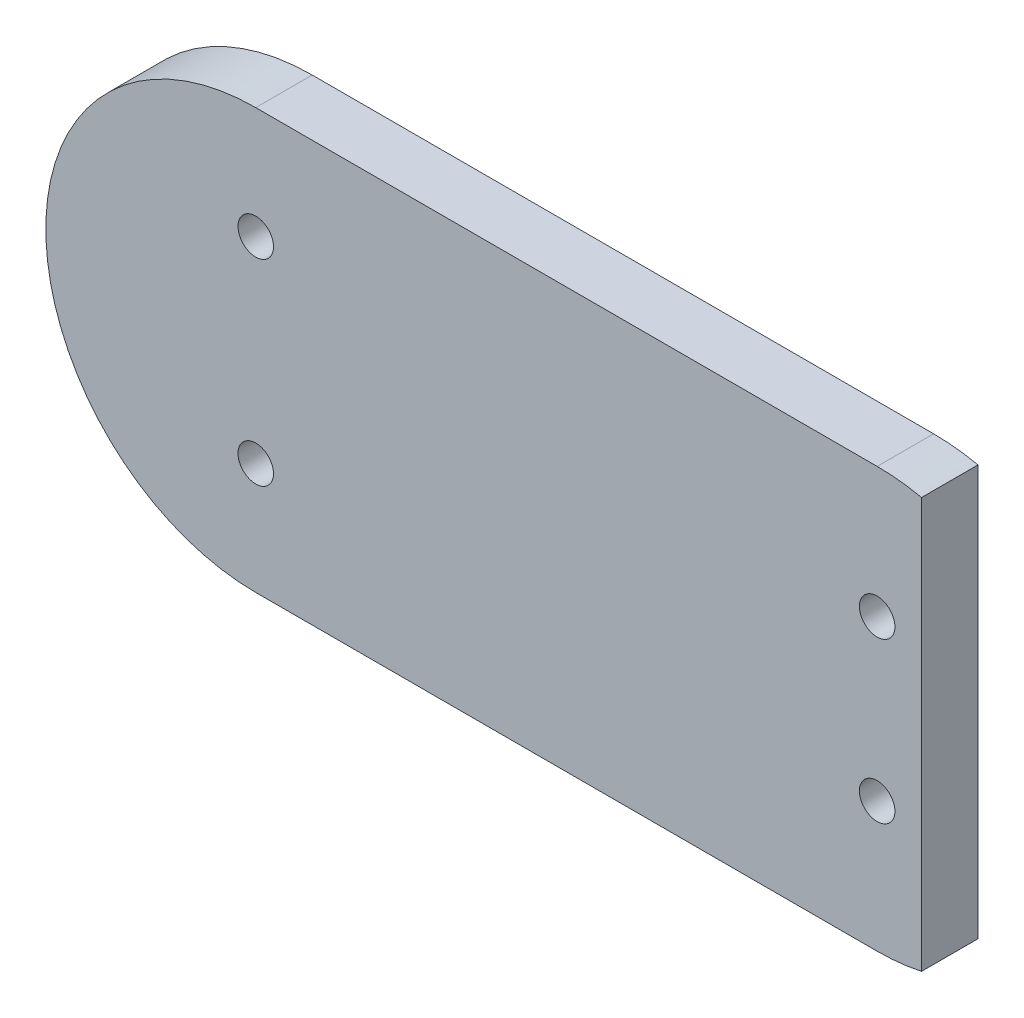
from build123d import *

# Parameters (mm, degrees)
BOSS_EXTRUDE1_DEPTH = 1.59
SKETCH4_R           = 1
CUT_EXTRUDE1_DEPTH  = 10
SKETCH5_R           = 1
CUT_EXTRUDE2_DEPTH  = 32.778902593


with BuildPart() as part:
    # Sketch3 → Boss-Extrude1 (new, symmetric)
    with BuildSketch(Plane.XY):
        with BuildLine():
            Line((-17.5, 11.825), (17.5, 11.825))
            ThreePointArc((17.5, 11.825), (29.325, 0), (17.5, -11.825))
            Line((17.5, -11.825), (-17.5, -11.825))
            ThreePointArc((-17.5, -11.825), (-29.325, 0), (-17.5, 11.825))
        make_face()
    extrude(amount=BOSS_EXTRUDE1_DEPTH, both=True)

    # Sketch4 → Cut-Extrude1 (cut)
    with BuildSketch(Plane.XY.offset(1.59)):
        with Locations((-17.5, 5.535)):
            Circle(SKETCH4_R)
        with Locations((-17.5, -5.535)):
            Circle(SKETCH4_R)
    extrude(amount=-CUT_EXTRUDE1_DEPTH, mode=Mode.SUBTRACT)

    # Sketch5 → Cut-Extrude2 (cut, through all)
    with BuildSketch(Plane.XY.offset(1.59)):
        with Locations((17.5, 4.5)):
            Circle(SKETCH5_R)
        with Locations((17.5, -4.5)):
            Circle(SKETCH5_R)
        with BuildLine():
            Line((20, 11.557708467), (20, -11.557708467))
            ThreePointArc((20, -11.557708467), (29.325, 0), (20, 11.557708467))
        make_face()
    extrude(amount=-CUT_EXTRUDE2_DEPTH, mode=Mode.SUBTRACT)


solid = part.part
